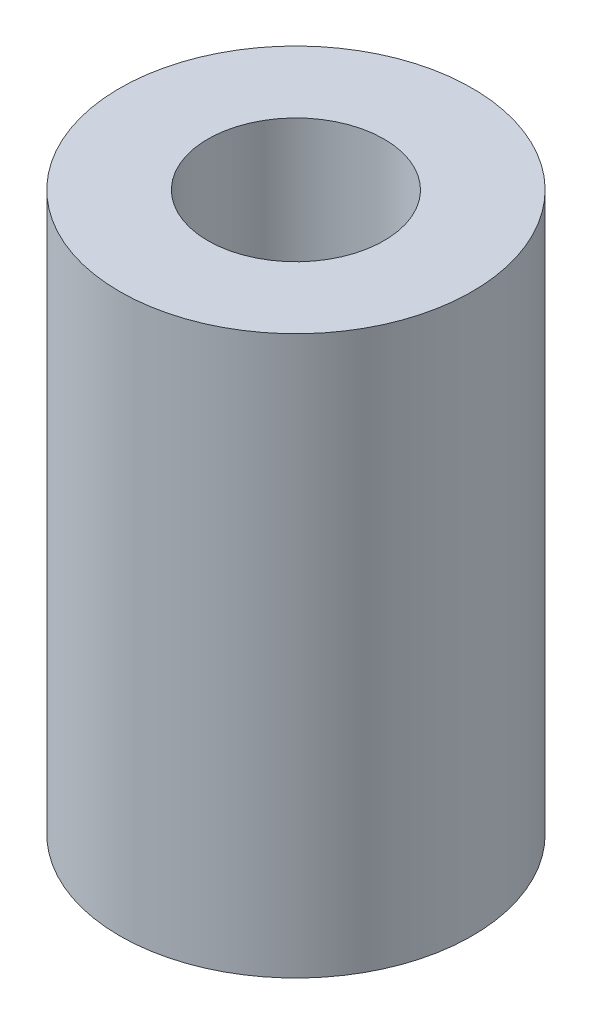
from build123d import *

# Parameters (mm, degrees)
SKETCH1_R   = 6
SKETCH1_R_2 = 3
BODY_DEPTH  = 19


with BuildPart() as part:
    # Sketch1 → Body (new body)
    with BuildSketch(Plane(origin=(0, 0, 0), x_dir=(1, 0, 0), z_dir=(0, 1, 0))):
        with Locations(Location((0, 0, 0), (0, 0, 270))):
            Circle(SKETCH1_R)
        with Locations(Location((0, 0, 0), (0, 0, 270))):
            Circle(SKETCH1_R_2, mode=Mode.SUBTRACT)
    extrude(amount=BODY_DEPTH)


solid = part.part
